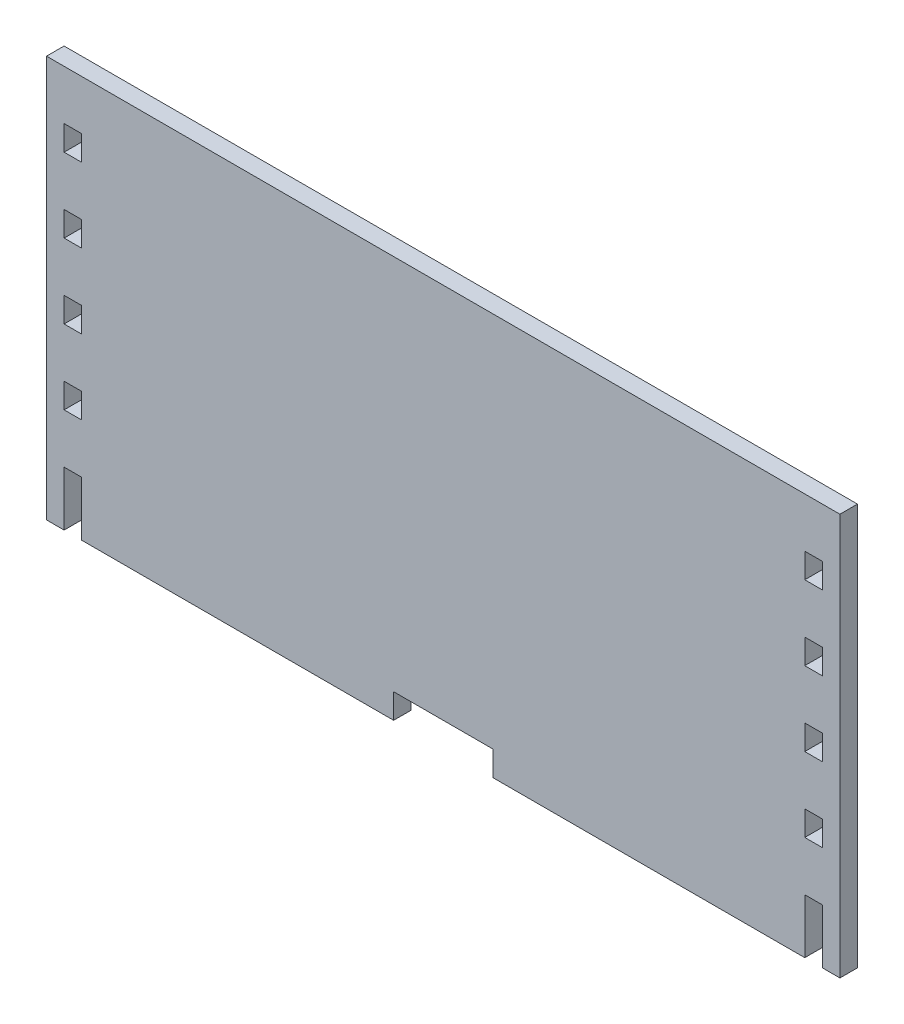
from build123d import *

# Parameters (mm, degrees)
SKETCH1_W           = 4.4958
SKETCH1_H           = 6.35
BOSS_EXTRUDE1_DEPTH = 4.4958
SKETCH2_W           = 25.4
SKETCH2_H           = 6.35
CUT_EXTRUDE1_DEPTH  = 228.799668827


with BuildPart() as part:
    # Sketch1 → Boss-Extrude1 (new body)
    with BuildSketch(Plane.XY):
        Polygon((0, 102.87), (0, 0), (4.5085, 0), (4.5085, 7.62), (4.5085, 13.97), (9.0043, 13.97), (9.0043, 7.62), (9.0043, 0), (194.1957, 0), (194.1957, 7.62), (194.1957, 13.97), (198.6915, 13.97), (198.6915, 7.62), (198.6915, 0), (203.2, 0), (203.2, 102.87), align=None)
        with Locations((6.7564, 29.845)):
            Rectangle(SKETCH1_W, SKETCH1_H, mode=Mode.SUBTRACT)
        with Locations((6.7564, 48.895)):
            Rectangle(SKETCH1_W, SKETCH1_H, mode=Mode.SUBTRACT)
        with Locations((196.4436, 29.845)):
            Rectangle(SKETCH1_W, SKETCH1_H, mode=Mode.SUBTRACT)
        with Locations((196.4436, 48.895)):
            Rectangle(SKETCH1_W, SKETCH1_H, mode=Mode.SUBTRACT)
        with Locations((6.7564, 67.945)):
            Rectangle(SKETCH1_W, SKETCH1_H, mode=Mode.SUBTRACT)
        with Locations((6.7564, 86.995)):
            Rectangle(SKETCH1_W, SKETCH1_H, mode=Mode.SUBTRACT)
        with Locations((196.4436, 67.945)):
            Rectangle(SKETCH1_W, SKETCH1_H, mode=Mode.SUBTRACT)
        with Locations((196.4436, 86.995)):
            Rectangle(SKETCH1_W, SKETCH1_H, mode=Mode.SUBTRACT)
    extrude(amount=BOSS_EXTRUDE1_DEPTH)

    # Sketch2 → Cut-Extrude1 (cut, through all)
    with BuildSketch(Plane.XY.offset(4.4958)):
        with Locations((101.6, 3.175)):
            Rectangle(SKETCH2_W, SKETCH2_H)
    extrude(amount=-CUT_EXTRUDE1_DEPTH, mode=Mode.SUBTRACT)


solid = part.part
